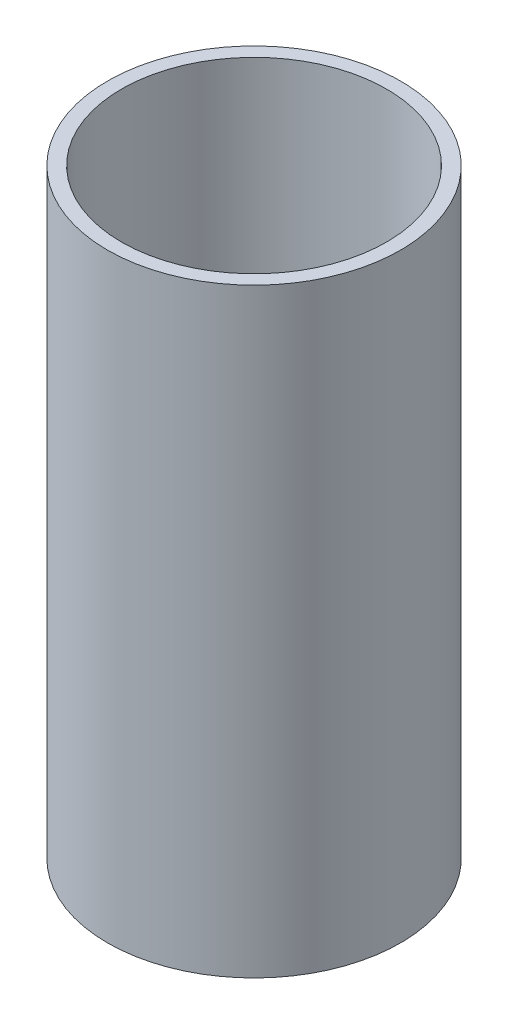
from build123d import *

# Parameters (mm, degrees)
SKETCH_1_R      = 10.5
SKETCH_1_R_2    = 9.5
EXTRUDE_1_DEPTH = 43


with BuildPart() as part:
    # 草圖1 → 填料-伸長1 (new body)
    with BuildSketch(Plane(origin=(0, 0, 0), x_dir=(1, 0, 0), z_dir=(0, 1, 0))):
        with Locations(Location((0, 0, 0), (0, 0, 270))):
            Circle(SKETCH_1_R)
        with Locations(Location((0, 0, 0), (0, 0, 270))):
            Circle(SKETCH_1_R_2, mode=Mode.SUBTRACT)
    extrude(amount=EXTRUDE_1_DEPTH)


solid = part.part
